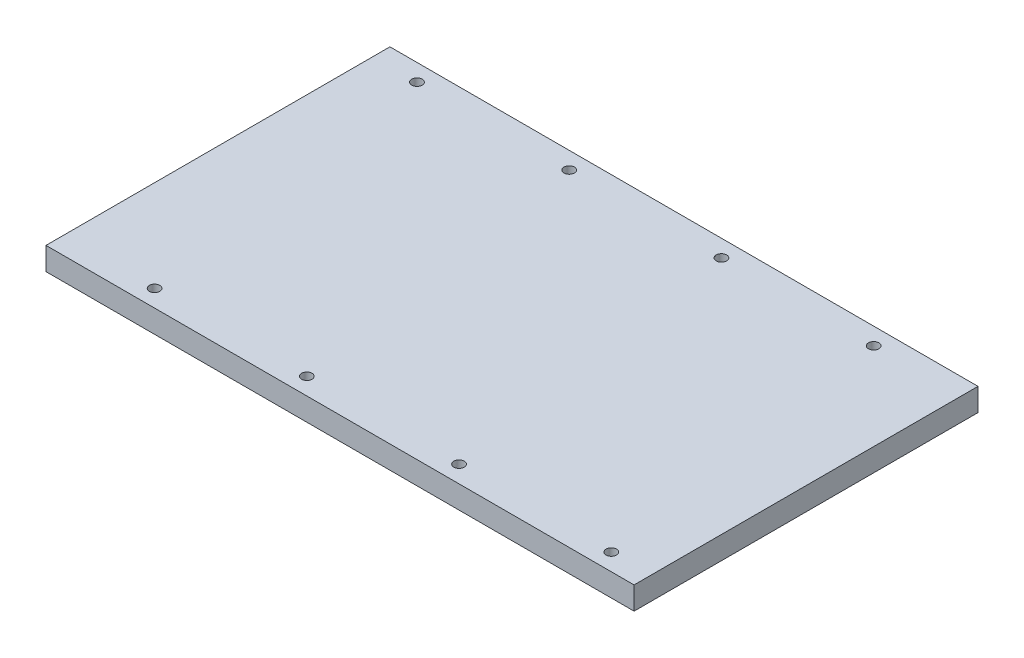
from build123d import *

# Parameters (mm, degrees)
SKETCH1_W           = 310
SKETCH1_H           = 181.3
SKETCH1_R           = 2.75
BOSS_EXTRUDE1_DEPTH = 12


with BuildPart() as part:
    # Sketch1 → Boss-Extrude1 (new body)
    with BuildSketch(Plane(origin=(0, 0, 0), x_dir=(1, 0, 0), z_dir=(0, 1, 0))):
        Rectangle(SKETCH1_W, SKETCH1_H)
        with Locations((-131.75, 81.65)):
            Circle(SKETCH1_R, mode=Mode.SUBTRACT)
        with Locations((-51.5, 81.65)):
            Circle(SKETCH1_R, mode=Mode.SUBTRACT)
        with Locations((28.75, 81.65)):
            Circle(SKETCH1_R, mode=Mode.SUBTRACT)
        with Locations((109, 81.65)):
            Circle(SKETCH1_R, mode=Mode.SUBTRACT)
        with Locations((-106.75, -81.65)):
            Circle(SKETCH1_R, mode=Mode.SUBTRACT)
        with Locations((-26.5, -81.65)):
            Circle(SKETCH1_R, mode=Mode.SUBTRACT)
        with Locations((53.75, -81.65)):
            Circle(SKETCH1_R, mode=Mode.SUBTRACT)
        with Locations((134, -81.65)):
            Circle(SKETCH1_R, mode=Mode.SUBTRACT)
    extrude(amount=BOSS_EXTRUDE1_DEPTH)


solid = part.part
